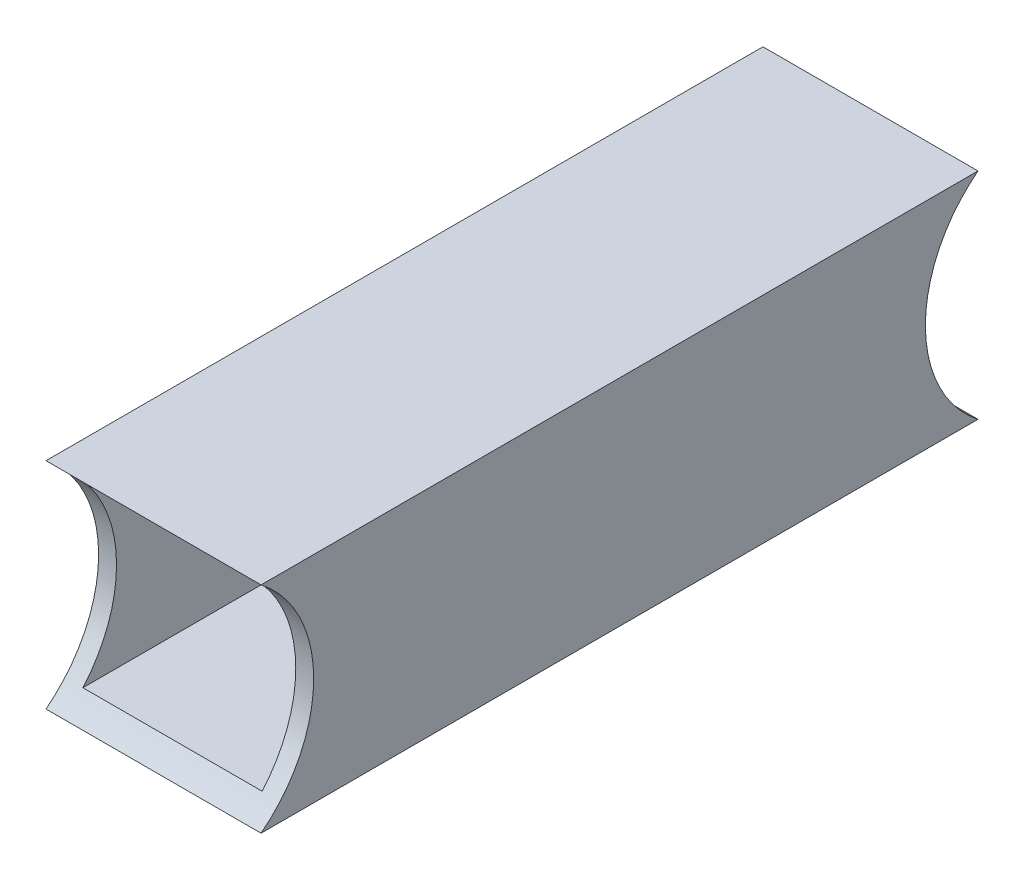
from build123d import *

# Parameters (mm, degrees)
BOSS_EXTRUDE1_DEPTH = 38.1
SKETCH2_W           = 31.75
SKETCH2_H           = 31.75
CUT_EXTRUDE1_DEPTH  = 152.704518851


with BuildPart() as part:
    # Sketch1 → Boss-Extrude1 (new body)
    with BuildSketch(Plane(origin=(0, 0, 0), x_dir=(0, 0, -1), z_dir=(1, 0, 0))):
        with BuildLine():
            ThreePointArc((24.13, 19.05), (21.675298243, 8.446305074), (14.810617813, 0))
            Line((14.810617813, 0), (141.813402187, 0))
            ThreePointArc((141.813402187, 0), (132.49402, 19.05), (141.813402187, 38.1))
            Line((141.813402187, 38.1), (14.810617813, 38.1))
            ThreePointArc((14.810617813, 38.1), (21.675298243, 29.653694926), (24.13, 19.05))
        make_face()
    extrude(amount=BOSS_EXTRUDE1_DEPTH)

    # Sketch2 → Cut-Extrude1 (cut, through all)
    with BuildSketch(Plane.XY):
        with Locations((19.05, 19.05)):
            Rectangle(SKETCH2_W, SKETCH2_H)
    extrude(amount=-CUT_EXTRUDE1_DEPTH, mode=Mode.SUBTRACT)


solid = part.part
